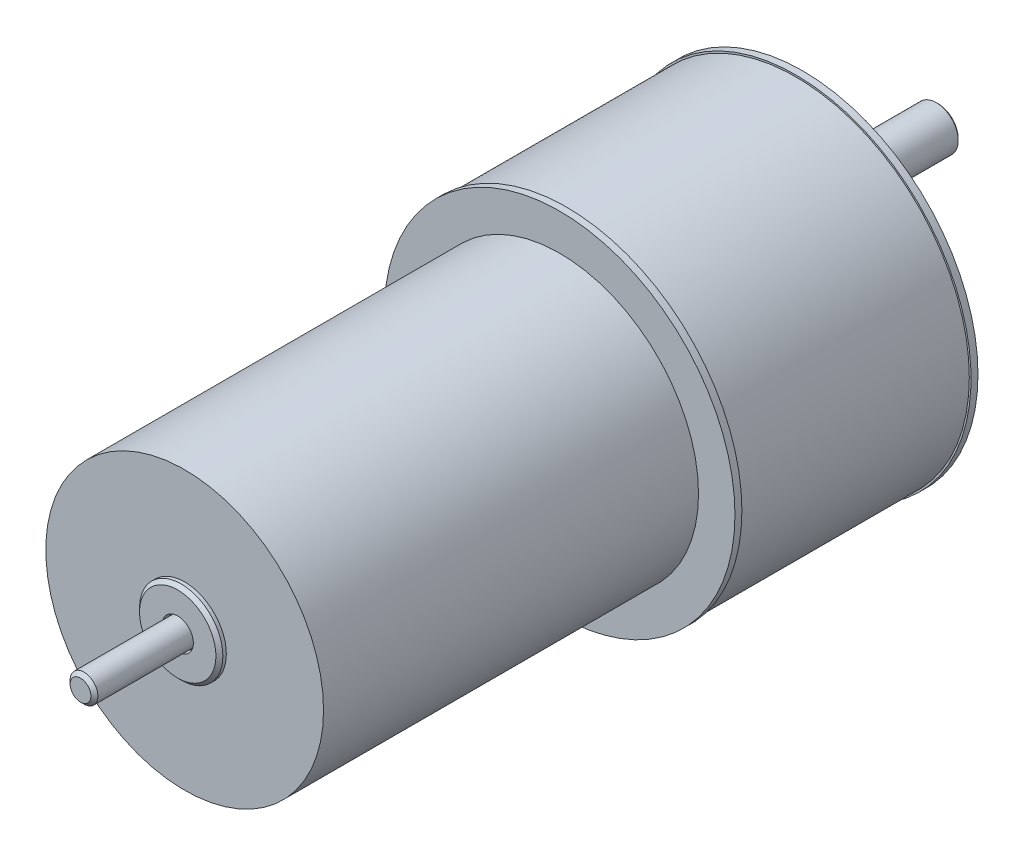
from build123d import *

# Parameters (mm, degrees)
ESBO_O1_R                 = 25.25
RESSALTO_EXTRUS_O1_DEPTH  = 35
ESBO_O2_R                 = 20
RESSALTO_EXTRUS_O2_DEPTH  = 54
ESBO_O3_R                 = 14.25
RESSALTO_EXTRUS_O3_DEPTH  = 1.5
FURO_ROSCADO_DE_M41_D     = 3.3
FURO_ROSCADO_DE_M41_DEPTH = 11.5
FURO_ROSCADO_DE_M41_TIP   = 0.991420021
ESBO_O7_R                 = 3.15
RESSALTO_EXTRUS_O4_DEPTH  = 18
CHANFRO1_SIZE             = 0.25
ESBO_O8_R                 = 2
RESSALTO_EXTRUS_O5_DEPTH  = 15
CHANFRO2_SIZE             = 0.5
ESBO_O9_R                 = 6
ESBO_O9_R_2               = 2.25
RESSALTO_EXTRUS_O6_DEPTH  = 1
CHANFRO3_SIZE             = 0.5
ESBO_O10_W                = 33
ESBO_O10_H                = 15.540446693


with BuildPart() as part:
    # Esboço1 → Ressalto-extrusão1 (new body)
    with BuildSketch(Plane.XY):
        Circle(ESBO_O1_R)
    extrude(amount=RESSALTO_EXTRUS_O1_DEPTH)

    # Esboço2 → Ressalto-extrusão2 (add)
    with BuildSketch(Plane.XY.offset(35)):
        Circle(ESBO_O2_R)
    extrude(amount=RESSALTO_EXTRUS_O2_DEPTH)

    # Esboço3 → Ressalto-extrusão3 (add)
    with BuildSketch(Plane(origin=(0, 0, 0), x_dir=(-1, 0, 0), z_dir=(0, 0, -1))):
        with Locations(Location((0, 0, 0), (0, 0, 180))):
            Circle(ESBO_O3_R)
    extrude(amount=RESSALTO_EXTRUS_O3_DEPTH)

    # Furo roscado de M41
    with Locations(Plane(origin=(0, 0, 0), x_dir=(-1, 0, 0), z_dir=(0, 0, -1))):
        with Locations((-19, 0), (19, 0)):
            Hole(FURO_ROSCADO_DE_M41_D / 2, depth=FURO_ROSCADO_DE_M41_DEPTH)
            with Locations((0, 0, -(FURO_ROSCADO_DE_M41_DEPTH + FURO_ROSCADO_DE_M41_TIP / 2))):  # 118° drill point
                Cone(0, FURO_ROSCADO_DE_M41_D / 2, FURO_ROSCADO_DE_M41_TIP, mode=Mode.SUBTRACT)

    # Esboço7 → Ressalto-extrusão4 (add)
    with BuildSketch(Plane(origin=(0, 0, -1.5), x_dir=(-1, 0, 0), z_dir=(0, 0, -1))):
        with Locations((0, 8.5)):
            Circle(ESBO_O7_R)
    extrude(amount=RESSALTO_EXTRUS_O4_DEPTH)

    # Chanfro1
    chanfro1_edges = [part.edges().sort_by_distance(p)[0] for p in [
        (3.15, 8.5, -19.5),
    ]]
    chamfer(chanfro1_edges, length=CHANFRO1_SIZE)

    # Esboço8 → Ressalto-extrusão5 (add)
    with BuildSketch(Plane.XY.offset(89)):
        Circle(ESBO_O8_R)
    extrude(amount=RESSALTO_EXTRUS_O5_DEPTH)

    # Chanfro2
    chanfro2_edges = [part.edges().sort_by_distance(p)[0] for p in [
        (-2, 0, 104),
    ]]
    chamfer(chanfro2_edges, length=CHANFRO2_SIZE)

    # Esboço9 → Ressalto-extrusão6 (add)
    with BuildSketch(Plane.XY.offset(89)):
        Circle(ESBO_O9_R)
        Circle(ESBO_O9_R_2, mode=Mode.SUBTRACT)
    extrude(amount=RESSALTO_EXTRUS_O6_DEPTH)

    # Chanfro3
    chanfro3_edges = [part.edges().sort_by_distance(p)[0] for p in [
        (-6, 0, 90),
    ]]
    chamfer(chanfro3_edges, length=CHANFRO3_SIZE)

    # Esboço10 → Corte-Revolução1 (revolve, cut)
    with BuildSketch(Plane(origin=(0, 0, 0), x_dir=(0, 0, -1), z_dir=(1, 0, 0)), mode=Mode.PRIVATE) as corte_revolu_o1_sk:
        with Locations((-17.5, 32.770223347)):
            Rectangle(ESBO_O10_W, ESBO_O10_H)
    revolve(corte_revolu_o1_sk.sketch.rotate(Axis((0, 0, 0), (0, 0, 1)), 90), axis=Axis((0, 0, 0), (0, 0, 1)), mode=Mode.SUBTRACT)


solid = part.part
